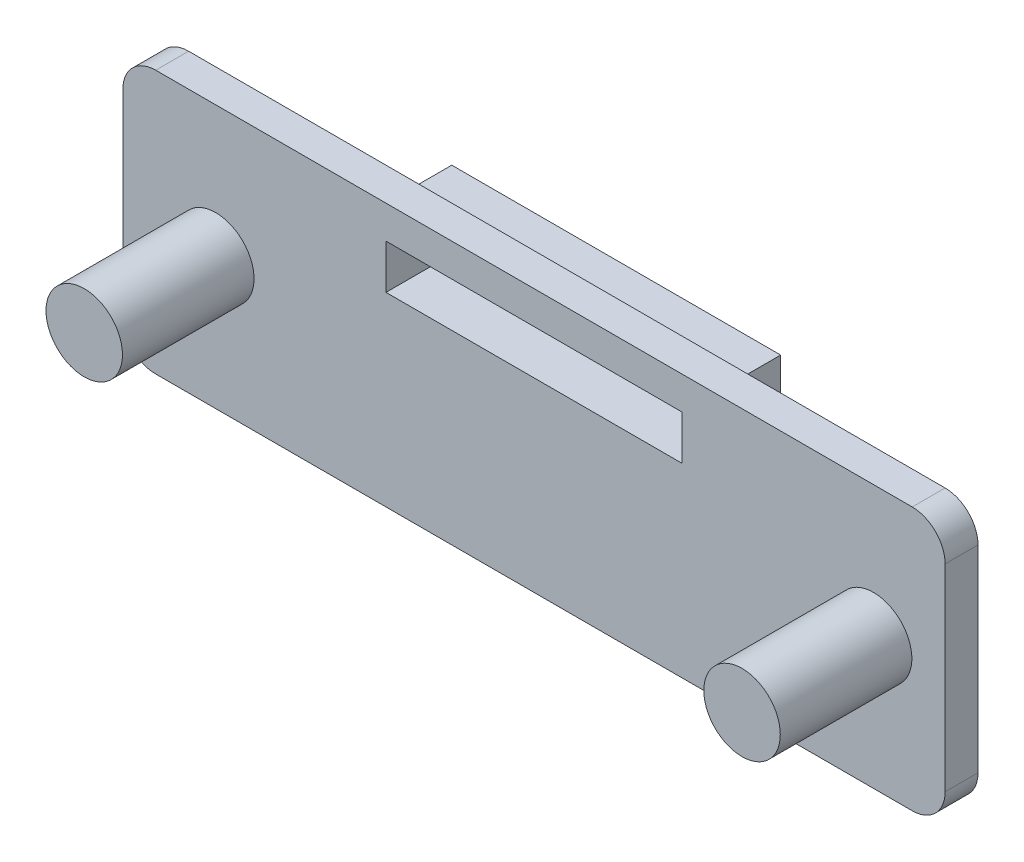
from build123d import *

# Parameters (mm, degrees)
SKETCH1_W           = 50
SKETCH1_H           = 16
BOSS_EXTRUDE1_DEPTH = 2
SKETCH2_R           = 2.325
BOSS_EXTRUDE2_DEPTH = 8
FILLET1_R           = 2
SKETCH3_W           = 20
SKETCH3_H           = 14
BOSS_EXTRUDE3_DEPTH = 3
SKETCH6_W           = 18
SKETCH6_H           = 2.7
CUT_EXTRUDE1_DEPTH  = 5


with BuildPart() as part:
    # Sketch1 → Boss-Extrude1 (new body)
    with BuildSketch(Plane.XY):
        with Locations((-5.32694175, 10.172569161)):
            Rectangle(SKETCH1_W, SKETCH1_H)
    extrude(amount=BOSS_EXTRUDE1_DEPTH)

    # Sketch2 → Boss-Extrude2 (add)
    with BuildSketch(Plane.XY.offset(2)):
        with Locations(Location((-24.675197488, 10.172569161, 0), (0, 0, 180))):
            Circle(SKETCH2_R)
        with Locations(Location((15.324802512, 10.172569161, 0), (0, 0, 180))):
            Circle(SKETCH2_R)
    extrude(amount=BOSS_EXTRUDE2_DEPTH)

    # Fillet1
    fillet1_edges = [part.edges().sort_by_distance(p)[0] for p in [
        (19.67305825, 2.172569161, 1),
        (-30.32694175, 2.172569161, 1),
        (-30.32694175, 18.172569161, 1),
        (19.67305825, 18.172569161, 1),
    ]]
    fillet(fillet1_edges, radius=FILLET1_R)

    # Sketch3 → Boss-Extrude3 (add)
    with BuildSketch(Plane(origin=(0, 0, 0), x_dir=(-1, 0, 0), z_dir=(0, 0, -1))):
        with Locations((5.32694175, 10.172569161)):
            Rectangle(SKETCH3_W, SKETCH3_H)
    extrude(amount=BOSS_EXTRUDE3_DEPTH)

    # Sketch6 → Cut-Extrude1 (cut)
    with BuildSketch(Plane(origin=(0, 0, -3), x_dir=(-1, 0, 0), z_dir=(0, 0, -1))):
        with Locations((5.32694175, 14.822569161)):
            Rectangle(SKETCH6_W, SKETCH6_H)
    extrude(amount=-CUT_EXTRUDE1_DEPTH, mode=Mode.SUBTRACT)


solid = part.part
